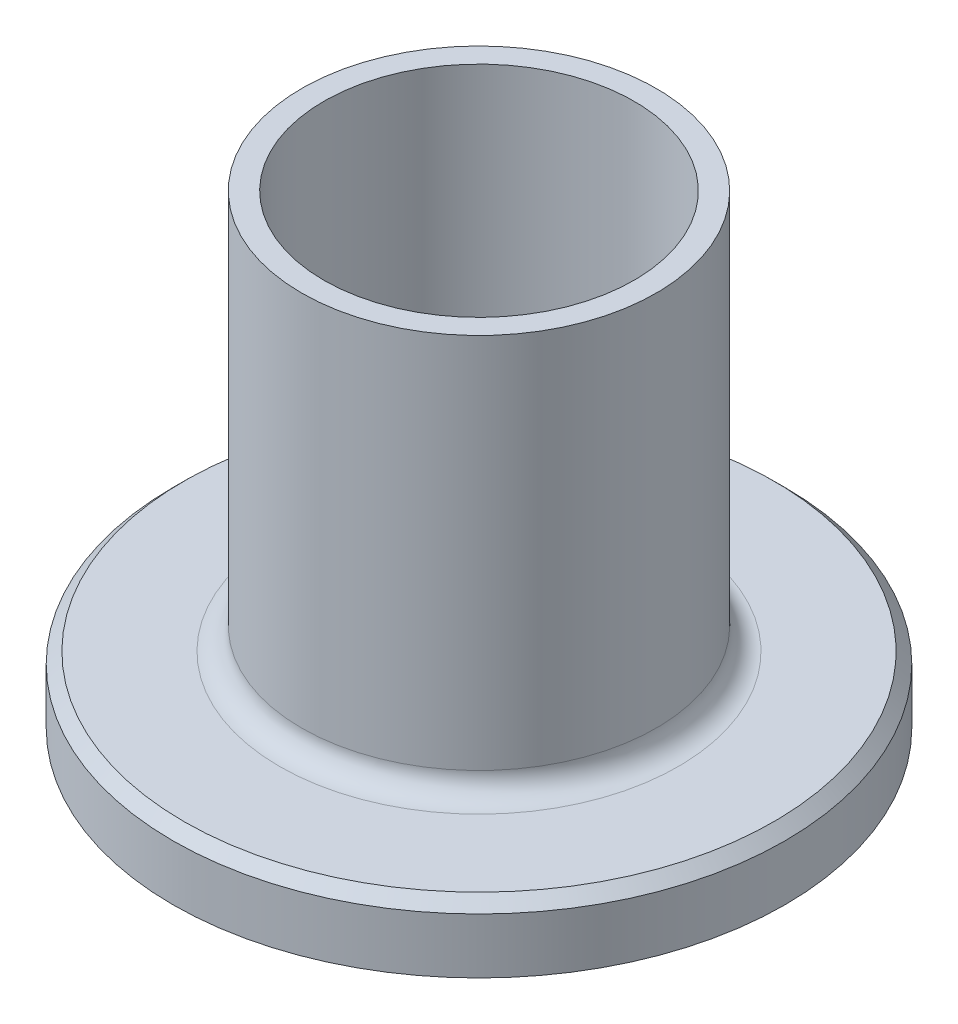
from build123d import *

# Parameters (mm, degrees)
SKETCH1_R           = 27.62
BOSS_EXTRUDE1_DEPTH = 6
SKETCH2_R           = 16
SKETCH2_R_2         = 14
BOSS_EXTRUDE2_DEPTH = 36
CUT_EXTRUDE1_START  = -36
SKETCH3_R           = 14
CUT_EXTRUDE1_DEPTH  = 36
CHAMFER1_SIZE       = 5
CHAMFER1_SIZE2      = 7.140740034
CHAMFER2_SIZE       = 1
SKETCH4_R           = 27
SKETCH4_R_2         = 25
CUT_EXTRUDE2_DEPTH  = 1.6
FILLET1_R           = 2
FILLET2_R           = 4


with BuildPart() as part:
    # Sketch1 → Boss-Extrude1 (new body)
    with BuildSketch(Plane(origin=(0, 0, 0), x_dir=(1, 0, 0), z_dir=(0, 1, 0))):
        with Locations(Location((0, 0, 0), (0, 0, 270))):
            Circle(SKETCH1_R)
    extrude(amount=BOSS_EXTRUDE1_DEPTH)

    # Sketch2 → Boss-Extrude2 (add)
    with BuildSketch(Plane(origin=(0, 6, 0), x_dir=(1, 0, 0), z_dir=(0, 1, 0))):
        with Locations(Location((0, 0, 0), (0, 0, 270))):
            Circle(SKETCH2_R)
        with Locations(Location((0, 0, 0), (0, 0, 270))):
            Circle(SKETCH2_R_2, mode=Mode.SUBTRACT)
    extrude(amount=BOSS_EXTRUDE2_DEPTH)

    # Sketch3 → Cut-Extrude1 (cut)
    with BuildSketch(Plane(origin=(0, 6, 0), x_dir=(1, 0, 0), z_dir=(0, 1, 0)).offset(CUT_EXTRUDE1_START)):
        with Locations(Location((0, 0, 0), (0, 0, 270))):
            Circle(SKETCH3_R)
    extrude(amount=CUT_EXTRUDE1_DEPTH, mode=Mode.SUBTRACT)

    # Chamfer1
    chamfer1_edges = [part.edges().sort_by_distance(p)[0] for p in [
        (0, 0, -14),
    ]]
    chamfer1_side = [part.faces().sort_by_distance(p)[0] for p in [
        (0, 21, -14),
    ]]
    chamfer(chamfer1_edges, length=CHAMFER1_SIZE, length2=CHAMFER1_SIZE2, reference=chamfer1_side[0])

    # Chamfer2
    chamfer2_edges = [part.edges().sort_by_distance(p)[0] for p in [
        (0, 6, -27.62),
    ]]
    chamfer(chamfer2_edges, length=CHAMFER2_SIZE)

    # Sketch4 → Cut-Extrude2 (cut)
    with BuildSketch(Plane.XZ):
        with Locations(Location((0, 0, 0), (0, 0, 270))):
            Circle(SKETCH4_R)
        with Locations(Location((0, 0, 0), (0, 0, 270))):
            Circle(SKETCH4_R_2, mode=Mode.SUBTRACT)
    extrude(amount=-CUT_EXTRUDE2_DEPTH, mode=Mode.SUBTRACT)

    # Fillet1
    fillet1_edges = [part.edges().sort_by_distance(p)[0] for p in [
        (0, 6, -16),
    ]]
    fillet(fillet1_edges, radius=FILLET1_R)

    # Fillet2
    fillet2_edges = [part.edges().sort_by_distance(p)[0] for p in [
        (0, 5, -14),
    ]]
    fillet(fillet2_edges, radius=FILLET2_R)


solid = part.part
